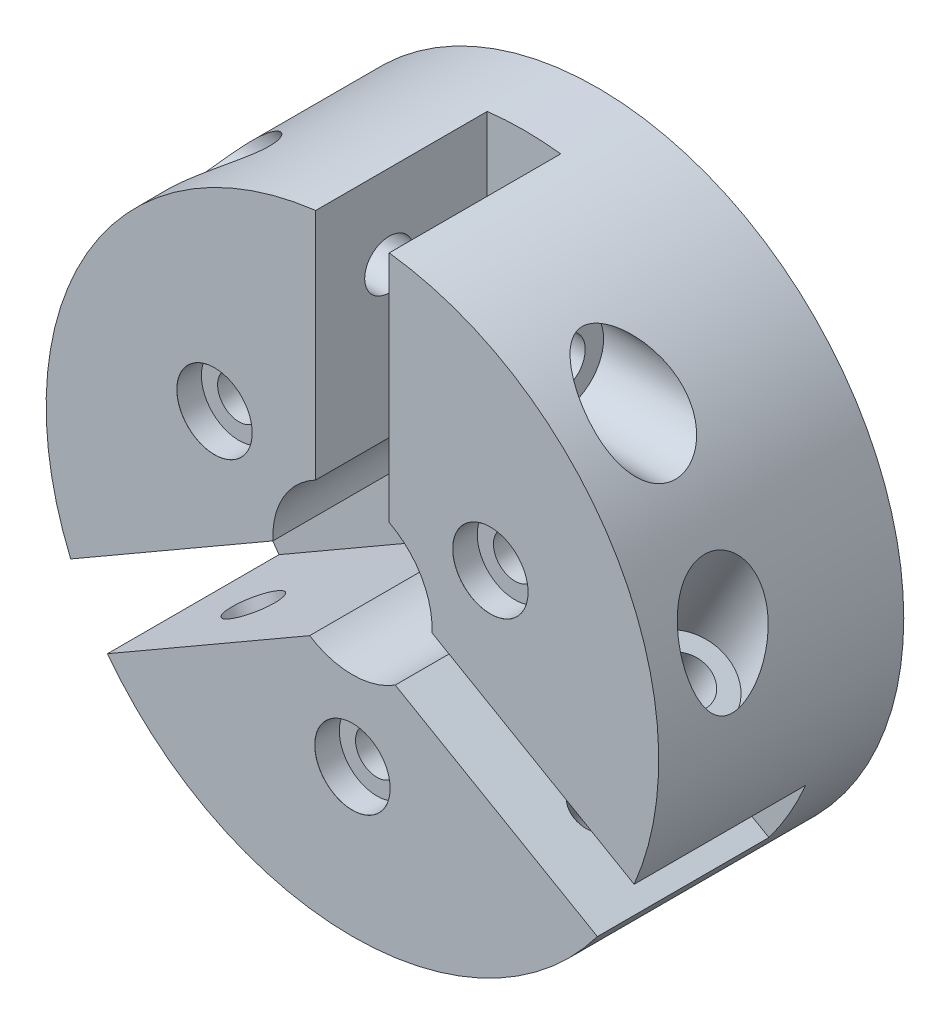
from build123d import *

# Parameters (mm, degrees)
BASE_SKETCH_R                            = 125
BASE_EXTRUDE_DEPTH                       = 100
TOP_THRU_HOLE_SKETCH_R                   = 10
SHANK_HOLE_EXTRUDED_CUT_DEPTH            = 204.100960116
OUTER_START                              = -101.827059
SKETCH2_6_R                              = 17.5
SKETCH2_6_R_2                            = 10
OUTER_SLEEVE_EXTRUDED_CUT_DEPTH          = 46.827059
OUTER_START_2                            = 55
TOP_THRU_HOLE_SKETCH_9_R                 = 17.5
OUTER_SLEEVE_EXTRUDED_CUT_2_DEPTH        = 46.827059
SLOTS_START                              = 100
SKETCH1_3_R                              = 32.5
SLOTS_EXTRUDED_CUT_DEPTH                 = 70
FRONT_START                              = 28.831406
SKETCH11_W                               = 30
SKETCH11_H                               = 70
FRONT_SLOT_EXTRUDED_CUT_DEPTH            = 96.168594
CIRCULAR_JAW_PATTERN_COUNT               = 3
COUNTERBORED_HOLE_CIRCULAR_PATTERN_COUNT = 3
CBORE_FOR_M16_HEX_HEAD_BOLT1_AT_2_COUNT  = 2
CBORE_FOR_M16_HEX_HEAD_BOLT1_AT_2_PITCH  = 112.583302492
CBORE_FOR_M16_HEX_HEAD_BOLT1_AT_3_COUNT  = 2
CBORE_FOR_M16_HEX_HEAD_BOLT1_AT_3_PITCH  = 112.583302492


with BuildPart() as part:
    # Base Sketch → Base Extrude (new body)
    with BuildSketch(Plane.XY):
        Circle(BASE_SKETCH_R)
    extrude(amount=BASE_EXTRUDE_DEPTH)

    # Top Thru Hole Sketch → Shank Hole Extruded Cut (cut, symmetric)
    with BuildSketch(Plane(origin=(0, 0, 0), x_dir=(0, 0, -1), z_dir=(1, 0, 0))):
        with Locations((-70, 90)):
            Circle(TOP_THRU_HOLE_SKETCH_R)
    shank_hole_extruded_cut = extrude(amount=SHANK_HOLE_EXTRUDED_CUT_DEPTH, both=True, mode=Mode.SUBTRACT)

    # Sketch2<6> → Outer Sleeve Extruded Cut (cut)
    with BuildSketch(Plane(origin=(0, 0, 0), x_dir=(0, 0, -1), z_dir=(1, 0, 0)).offset(OUTER_START)):
        with Locations((-70, 90)):
            Circle(SKETCH2_6_R)
        with Locations((-70, 90)):
            Circle(SKETCH2_6_R_2, mode=Mode.SUBTRACT)
    outer_sleeve_extruded_cut = extrude(amount=OUTER_SLEEVE_EXTRUDED_CUT_DEPTH, mode=Mode.SUBTRACT)

    # Top Thru Hole Sketch<9> → Outer Sleeve Extruded Cut 2 (cut)
    with BuildSketch(Plane(origin=(0, 0, 0), x_dir=(0, 0, -1), z_dir=(1, 0, 0)).offset(OUTER_START_2)):
        with Locations((-70, 90)):
            Circle(TOP_THRU_HOLE_SKETCH_9_R)
    outer_sleeve_extruded_cut_2 = extrude(amount=OUTER_SLEEVE_EXTRUDED_CUT_2_DEPTH, mode=Mode.SUBTRACT)

    # Sketch1<3> → Slots Extruded Cut (cut)
    with BuildSketch(Plane.XY.offset(SLOTS_START)):
        Circle(SKETCH1_3_R)
    extrude(amount=-SLOTS_EXTRUDED_CUT_DEPTH, mode=Mode.SUBTRACT)

    # Sketch11 → Front Slot Extruded Cut (cut)
    with BuildSketch(Plane(origin=(0, 0, 0), x_dir=(1, 0, 0), z_dir=(0, 1, 0)).offset(FRONT_START)):
        with Locations((0, -65)):
            Rectangle(SKETCH11_W, SKETCH11_H)
    front_slot_extruded_cut = extrude(amount=FRONT_SLOT_EXTRUDED_CUT_DEPTH, mode=Mode.SUBTRACT)

    # Circular Jaw Pattern: Front Slot Extruded Cut ×3 about axis
    circular_jaw_pattern_axis = Axis((0, 0, 0), (0, 0, 1))
    for i in range(1, CIRCULAR_JAW_PATTERN_COUNT):
        add(front_slot_extruded_cut.rotate(circular_jaw_pattern_axis, i * 360 / CIRCULAR_JAW_PATTERN_COUNT), mode=Mode.SUBTRACT)

    # Counterbored Hole Circular Pattern: Shank Hole Extruded Cut, Outer Sleeve Extruded Cut, Outer Sleeve Extruded Cut 2 ×3 about axis
    counterbored_hole_circular_pattern_axis = Axis((0, 0, 0), (0, 0, 1))
    add([shank_hole_extruded_cut.rotate(counterbored_hole_circular_pattern_axis, i * 360 / COUNTERBORED_HOLE_CIRCULAR_PATTERN_COUNT) for i in range(1, COUNTERBORED_HOLE_CIRCULAR_PATTERN_COUNT)], mode=Mode.SUBTRACT)
    add([outer_sleeve_extruded_cut.rotate(counterbored_hole_circular_pattern_axis, i * 360 / COUNTERBORED_HOLE_CIRCULAR_PATTERN_COUNT) for i in range(1, COUNTERBORED_HOLE_CIRCULAR_PATTERN_COUNT)], mode=Mode.SUBTRACT)
    add([outer_sleeve_extruded_cut_2.rotate(counterbored_hole_circular_pattern_axis, i * 360 / COUNTERBORED_HOLE_CIRCULAR_PATTERN_COUNT) for i in range(1, COUNTERBORED_HOLE_CIRCULAR_PATTERN_COUNT)], mode=Mode.SUBTRACT)

    # Sketch15 → CBORE for M16 Hex Head Bolt1 (revolve, cut)
    with BuildSketch(Plane(origin=(56.291651246, 32.5, 100), x_dir=(0, -1, 0), z_dir=(1, 0, 0))):
        Polygon((0, 0), (0, 100), (8.75, 100), (8.75, 10), (15.3565, 10), (15.3565, 0.020977491), (15.3815, 0), align=None)
    cbore_for_m16_hex_head_bolt1 = revolve(axis=Axis((56.291651246, 32.5, 106.35), (0, 0, -1)), mode=Mode.SUBTRACT)

    # CBORE for M16 Hex Head Bolt1 at 2: CBORE for M16 Hex Head Bolt1 ×2
    with Locations(*[Vector(-0.5000000000000011, -0.866025403784438, 0) * (i * CBORE_FOR_M16_HEX_HEAD_BOLT1_AT_2_PITCH) for i in range(1, CBORE_FOR_M16_HEX_HEAD_BOLT1_AT_2_COUNT)]):
        add(cbore_for_m16_hex_head_bolt1, mode=Mode.SUBTRACT)

    # CBORE for M16 Hex Head Bolt1 at 3: CBORE for M16 Hex Head Bolt1 ×2
    with Locations(*[(-i * CBORE_FOR_M16_HEX_HEAD_BOLT1_AT_3_PITCH, 0, 0) for i in range(1, CBORE_FOR_M16_HEX_HEAD_BOLT1_AT_3_COUNT)]):
        add(cbore_for_m16_hex_head_bolt1, mode=Mode.SUBTRACT)


solid = part.part
